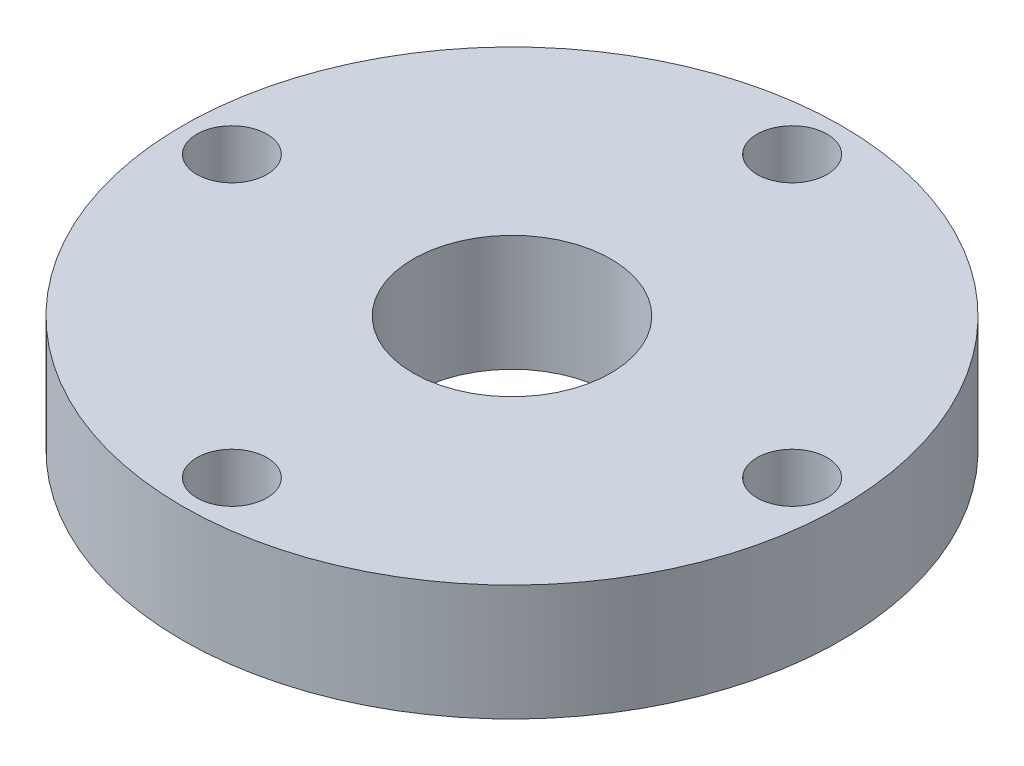
from build123d import *

# Parameters (mm, degrees)
SKETCH1_W           = 22.352
SKETCH1_H           = 63.5
CUT_EXTRUDE2_START  = -11.176
SKETCH2_R           = 19.05
CUT_EXTRUDE2_DEPTH  = 22.352
CUT_EXTRUDE4_START  = 11.176
SKETCH3_R           = 4.3688
CUT_EXTRUDE4_DEPTH  = 127
CUT_EXTRUDE6_START  = 11.176
SKETCH4_R           = 6.7437
CUT_EXTRUDE6_DEPTH  = 9.652
CUT_EXTRUDE8_START  = 11.176
SKETCH5_R           = 4.3688
CUT_EXTRUDE8_DEPTH  = 127
CUT_EXTRUDE10_START = 11.176
SKETCH6_R           = 6.7437
CUT_EXTRUDE10_DEPTH = 9.652


with BuildPart() as part:
    # Sketch1 → Revolve1 (revolve)
    with BuildSketch(Plane(origin=(0, 0, 0), x_dir=(0, 1, 0), z_dir=(0, 0, 1)), mode=Mode.PRIVATE) as revolve1_sk:
        with Locations((0, 31.75)):
            Rectangle(SKETCH1_W, SKETCH1_H)
    revolve(revolve1_sk.sketch.rotate(Axis((0, -36.576, 0), (0, 1, 0)), 270), axis=Axis((0, -36.576, 0), (0, 1, 0)))

    # Sketch2 → Cut-Extrude2 (cut)
    with BuildSketch(Plane(origin=(0, 0, 0), x_dir=(-1, 0, 0), z_dir=(0, 1, 0)).offset(CUT_EXTRUDE2_START)):
        with Locations(Location((0, 0, 0), (0, 0, 90))):
            Circle(SKETCH2_R)
    extrude(amount=CUT_EXTRUDE2_DEPTH, mode=Mode.SUBTRACT)

    # Sketch3 → Cut-Extrude4 (cut)
    with BuildSketch(Plane(origin=(0, 0, 0), x_dir=(-1, 0, 0), z_dir=(0, 1, 0)).offset(CUT_EXTRUDE4_START)):
        with Locations(Location((53.975, 0, 0), (0, 0, 90))):
            Circle(SKETCH3_R)
    extrude(amount=-CUT_EXTRUDE4_DEPTH, mode=Mode.SUBTRACT)

    # Sketch4 → Cut-Extrude6 (cut)
    with BuildSketch(Plane(origin=(0, 0, 0), x_dir=(-1, 0, 0), z_dir=(0, 1, 0)).offset(CUT_EXTRUDE6_START)):
        with Locations(Location((53.975, 0, 0), (0, 0, 90))):
            Circle(SKETCH4_R)
    extrude(amount=-CUT_EXTRUDE6_DEPTH, mode=Mode.SUBTRACT)

    # Sketch5 → Cut-Extrude8 (cut)
    with BuildSketch(Plane(origin=(0, 0, 0), x_dir=(-1, 0, 0), z_dir=(0, 1, 0)).offset(CUT_EXTRUDE8_START)):
        with Locations(Location((0, 53.975, 0), (0, 0, 90))):
            Circle(SKETCH5_R)
        with Locations(Location((-53.975, 0, 0), (0, 0, 90))):
            Circle(SKETCH5_R)
        with Locations(Location((0, -53.975, 0), (0, 0, 90))):
            Circle(SKETCH5_R)
    extrude(amount=-CUT_EXTRUDE8_DEPTH, mode=Mode.SUBTRACT)

    # Sketch6 → Cut-Extrude10 (cut)
    with BuildSketch(Plane(origin=(0, 0, 0), x_dir=(-1, 0, 0), z_dir=(0, 1, 0)).offset(CUT_EXTRUDE10_START)):
        with Locations(Location((0, 53.975, 0), (0, 0, 90))):
            Circle(SKETCH6_R)
        with Locations(Location((-53.975, 0, 0), (0, 0, 90))):
            Circle(SKETCH6_R)
        with Locations(Location((0, -53.975, 0), (0, 0, 90))):
            Circle(SKETCH6_R)
    extrude(amount=-CUT_EXTRUDE10_DEPTH, mode=Mode.SUBTRACT)


solid = part.part
